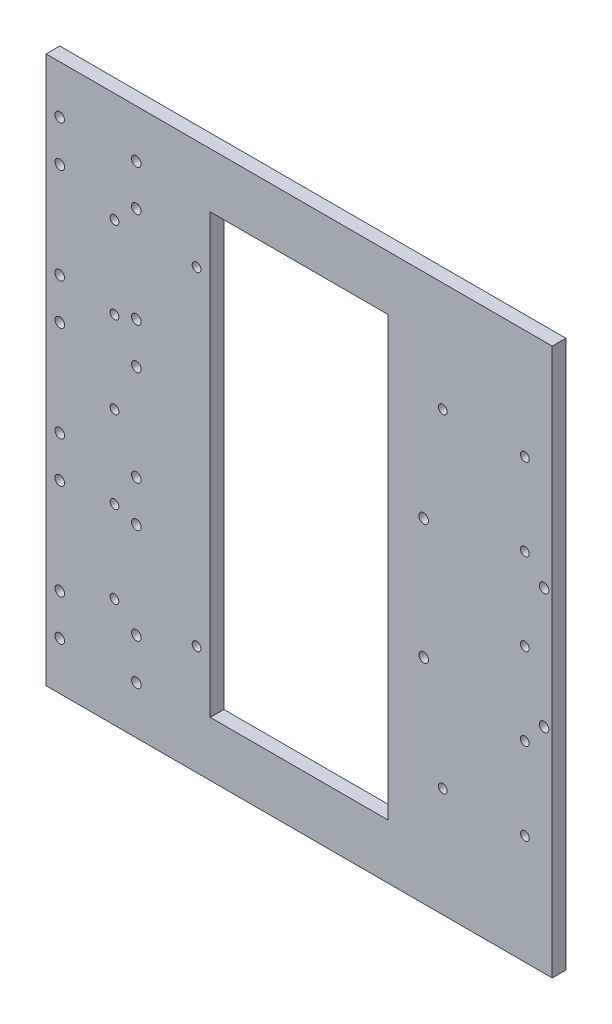
from build123d import *

# Parameters (mm, degrees)
SKETCH_1_W          = 170
SKETCH_1_H          = 140
EXTRUDE_1_DEPTH     = 5
CUT_EXTRUDE_1_DEPTH = 5
SKETCH_4_R          = 1.6
CUT_EXTRUDE_2_DEPTH = 5
SKETCH_9_W          = 170
SKETCH_9_H          = 5
EXTRUDE_2_DEPTH     = 30
SKETCH_10_W         = 170
SKETCH_10_H         = 5
EXTRUDE_3_DEPTH     = 30
SKETCH_8_W          = 65
SKETCH_8_H          = 160
CUT_EXTRUDE_5_DEPTH = 30
SKETCH_6_R          = 1.75
CUT_EXTRUDE_6_DEPTH = 30
SKETCH_13_W         = 5
SKETCH_13_H         = 200
EXTRUDE_4_DEPTH     = 15
SKETCH_14_R         = 1.75
CUT_EXTRUDE_7_DEPTH = 15


with BuildPart() as part:
    # 草图1 → 凸台-拉伸1 (new body)
    with BuildSketch(Plane.XY):
        with Locations((85, 70)):
            Rectangle(SKETCH_1_W, SKETCH_1_H)
    extrude(amount=EXTRUDE_1_DEPTH)

    # 草图3 → 切除-拉伸1 (cut)
    with BuildSketch(Plane.XY.offset(5)):
        with BuildLine():
            ThreePointArc((10, 128.4), (11.13137085, 128.86862915), (11.6, 130))
            Line((11.6, 130), (10, 130))
            Line((10, 130), (10, 128.4))
        make_face()
        with BuildLine():
            Line((10, 130), (11.6, 130))
            ThreePointArc((11.6, 130), (8.86862915, 131.13137085), (10, 128.4))
            Line((10, 128.4), (10, 130))
        make_face()
        with BuildLine():
            ThreePointArc((10, 128.4), (11.13137085, 128.86862915), (11.6, 130))
            Line((11.6, 130), (10, 130))
            Line((10, 130), (10, 128.4))
        make_face()
        with BuildLine():
            Line((10, 130), (11.6, 130))
            ThreePointArc((11.6, 130), (8.86862915, 131.13137085), (10, 128.4))
            Line((10, 128.4), (10, 130))
        make_face()
        with BuildLine():
            ThreePointArc((11.6, 10), (11.13137085, 11.13137085), (10, 11.6))
            Line((10, 11.6), (10, 10))
            Line((10, 10), (11.6, 10))
        make_face()
        with BuildLine():
            Line((10, 10), (10, 11.6))
            ThreePointArc((10, 11.6), (8.86862915, 8.86862915), (11.6, 10))
            Line((11.6, 10), (10, 10))
        make_face()
        with BuildLine():
            ThreePointArc((11.6, 10), (11.13137085, 11.13137085), (10, 11.6))
            Line((10, 11.6), (10, 10))
            Line((10, 10), (11.6, 10))
        make_face()
        with BuildLine():
            Line((10, 10), (10, 11.6))
            ThreePointArc((10, 11.6), (8.86862915, 8.86862915), (11.6, 10))
            Line((11.6, 10), (10, 10))
        make_face()
        with BuildLine():
            ThreePointArc((161.6, 10), (161.13137085, 11.13137085), (160, 11.6))
            Line((160, 11.6), (160, 10))
            Line((160, 10), (158.4, 10))
            ThreePointArc((158.4, 10), (160, 8.4), (161.6, 10))
        make_face()
        with BuildLine():
            Line((160, 10), (160, 11.6))
            ThreePointArc((160, 11.6), (158.86862915, 11.13137085), (158.4, 10))
            Line((158.4, 10), (160, 10))
        make_face()
        with BuildLine():
            ThreePointArc((161.6, 10), (161.13137085, 11.13137085), (160, 11.6))
            Line((160, 11.6), (160, 10))
            Line((160, 10), (158.4, 10))
            ThreePointArc((158.4, 10), (160, 8.4), (161.6, 10))
        make_face()
        with BuildLine():
            Line((160, 10), (160, 11.6))
            ThreePointArc((160, 11.6), (158.86862915, 11.13137085), (158.4, 10))
            Line((158.4, 10), (160, 10))
        make_face()
        with BuildLine():
            ThreePointArc((161.6, 130), (160, 131.6), (158.4, 130))
            Line((158.4, 130), (160, 130))
            Line((160, 130), (160, 128.4))
            ThreePointArc((160, 128.4), (161.13137085, 128.86862915), (161.6, 130))
        make_face()
        with BuildLine():
            Line((160, 130), (158.4, 130))
            ThreePointArc((158.4, 130), (158.86862915, 128.86862915), (160, 128.4))
            Line((160, 128.4), (160, 130))
        make_face()
        with BuildLine():
            ThreePointArc((161.6, 130), (160, 131.6), (158.4, 130))
            Line((158.4, 130), (160, 130))
            Line((160, 130), (160, 128.4))
            ThreePointArc((160, 128.4), (161.13137085, 128.86862915), (161.6, 130))
        make_face()
        with BuildLine():
            Line((160, 130), (158.4, 130))
            ThreePointArc((158.4, 130), (158.86862915, 128.86862915), (160, 128.4))
            Line((160, 128.4), (160, 130))
        make_face()
    extrude(amount=-CUT_EXTRUDE_1_DEPTH, mode=Mode.SUBTRACT)

    # 草图4 → 切除-拉伸2 (cut)
    with BuildSketch(Plane.XY.offset(5)):
        with Locations((10, 130)):
            Circle(SKETCH_4_R)
        with Locations((40, 130)):
            Circle(SKETCH_4_R)
        with Locations((70, 130)):
            Circle(SKETCH_4_R)
        with Locations((100, 130)):
            Circle(SKETCH_4_R)
        with Locations((130, 130)):
            Circle(SKETCH_4_R)
        with Locations((10, 10)):
            Circle(SKETCH_4_R)
        with Locations((40, 10)):
            Circle(SKETCH_4_R)
        with Locations((70, 10)):
            Circle(SKETCH_4_R)
        with Locations((100, 10)):
            Circle(SKETCH_4_R)
        with Locations((130, 10)):
            Circle(SKETCH_4_R)
        with Locations((160, 130)):
            Circle(SKETCH_4_R)
        with Locations((10, 100)):
            Circle(SKETCH_4_R)
        with Locations((160, 100)):
            Circle(SKETCH_4_R)
        with Locations((10, 70)):
            Circle(SKETCH_4_R)
        with Locations((160, 70)):
            Circle(SKETCH_4_R)
        with Locations((10, 40)):
            Circle(SKETCH_4_R)
        with Locations((160, 40)):
            Circle(SKETCH_4_R)
    extrude(amount=-CUT_EXTRUDE_2_DEPTH, mode=Mode.SUBTRACT)

    # 草图9 → 凸台-拉伸2 (add)
    with BuildSketch(Plane.XZ):
        with Locations((85, 2.5)):
            Rectangle(SKETCH_9_W, SKETCH_9_H)
    extrude(amount=EXTRUDE_2_DEPTH)

    # 草图10 → 凸台-拉伸3 (add)
    with BuildSketch(Plane(origin=(0, 140, 0), x_dir=(1, 0, 0), z_dir=(0, 1, 0))):
        with Locations((85, -2.5)):
            Rectangle(SKETCH_10_W, SKETCH_10_H)
    extrude(amount=EXTRUDE_3_DEPTH)

    # 草图8 → 切除-拉伸5 (cut)
    with BuildSketch(Plane.XY.offset(5)):
        with Locations((77.5, 70)):
            Rectangle(SKETCH_8_W, SKETCH_8_H)
    extrude(amount=-CUT_EXTRUDE_5_DEPTH, mode=Mode.SUBTRACT)

    # 草图6 → 切除-拉伸6 (cut)
    with BuildSketch(Plane.XY.offset(5)):
        with Locations((123, 92)):
            Circle(SKETCH_6_R)
        with Locations((167, 92)):
            Circle(SKETCH_6_R)
        with Locations((123, 48)):
            Circle(SKETCH_6_R)
        with Locations((167, 48)):
            Circle(SKETCH_6_R)
    extrude(amount=-CUT_EXTRUDE_6_DEPTH, mode=Mode.SUBTRACT)

    # 草图13 → 凸台-拉伸4 (add)
    with BuildSketch(Plane.ZY):
        with Locations((2.5, 70)):
            Rectangle(SKETCH_13_W, SKETCH_13_H)
    extrude(amount=EXTRUDE_4_DEPTH)

    # 草图14 → 切除-拉伸7 (cut)
    with BuildSketch(Plane.XY.offset(5)):
        with BuildLine():
            ThreePointArc((-8.25, 152.5), (-11.237436867, 153.737436867), (-10, 150.75))
            Line((-10, 150.75), (-10, 152.5))
            Line((-10, 152.5), (-8.25, 152.5))
        make_face()
        with BuildLine():
            Line((-10, 152.5), (-10, 150.75))
            ThreePointArc((-10, 150.75), (-8.762563133, 151.262563133), (-8.25, 152.5))
            Line((-8.25, 152.5), (-10, 152.5))
        make_face()
        with BuildLine():
            ThreePointArc((-8.25, 152.5), (-11.237436867, 153.737436867), (-10, 150.75))
            Line((-10, 150.75), (-10, 152.5))
            Line((-10, 152.5), (-8.25, 152.5))
        make_face()
        with BuildLine():
            Line((-10, 152.5), (-10, 150.75))
            ThreePointArc((-10, 150.75), (-8.762563133, 151.262563133), (-8.25, 152.5))
            Line((-8.25, 152.5), (-10, 152.5))
        make_face()
        with BuildLine():
            Line((-10, 139.25), (-10, 137.5))
            Line((-10, 137.5), (-8.25, 137.5))
            ThreePointArc((-8.25, 137.5), (-8.762563133, 138.737436867), (-10, 139.25))
        make_face()
        with BuildLine():
            Line((-8.25, 137.5), (-10, 137.5))
            Line((-10, 137.5), (-10, 139.25))
            ThreePointArc((-10, 139.25), (-11.237436867, 136.262563133), (-8.25, 137.5))
        make_face()
        with BuildLine():
            Line((-10, 139.25), (-10, 137.5))
            Line((-10, 137.5), (-8.25, 137.5))
            ThreePointArc((-8.25, 137.5), (-8.762563133, 138.737436867), (-10, 139.25))
        make_face()
        with BuildLine():
            Line((-8.25, 137.5), (-10, 137.5))
            Line((-10, 137.5), (-10, 139.25))
            ThreePointArc((-10, 139.25), (-11.237436867, 136.262563133), (-8.25, 137.5))
        make_face()
        with BuildLine():
            ThreePointArc((18, 139.25), (16.762563133, 138.737436867), (16.25, 137.5))
            Line((16.25, 137.5), (18, 137.5))
            Line((18, 137.5), (18, 139.25))
        make_face()
        with BuildLine():
            Line((18, 137.5), (16.25, 137.5))
            ThreePointArc((16.25, 137.5), (18, 135.75), (19.75, 137.5))
            ThreePointArc((19.75, 137.5), (19.237436867, 138.737436867), (18, 139.25))
            Line((18, 139.25), (18, 137.5))
        make_face()
        with BuildLine():
            ThreePointArc((18, 139.25), (16.762563133, 138.737436867), (16.25, 137.5))
            Line((16.25, 137.5), (18, 137.5))
            Line((18, 137.5), (18, 139.25))
        make_face()
        with BuildLine():
            Line((18, 137.5), (16.25, 137.5))
            ThreePointArc((16.25, 137.5), (18, 135.75), (19.75, 137.5))
            ThreePointArc((19.75, 137.5), (19.237436867, 138.737436867), (18, 139.25))
            Line((18, 139.25), (18, 137.5))
        make_face()
        with BuildLine():
            ThreePointArc((16.25, 152.5), (16.762563133, 151.262563133), (18, 150.75))
            Line((18, 150.75), (18, 152.5))
            Line((18, 152.5), (16.25, 152.5))
        make_face()
        with BuildLine():
            Line((18, 152.5), (18, 150.75))
            ThreePointArc((18, 150.75), (19.237436867, 151.262563133), (19.75, 152.5))
            ThreePointArc((19.75, 152.5), (18, 154.25), (16.25, 152.5))
            Line((16.25, 152.5), (18, 152.5))
        make_face()
        with BuildLine():
            ThreePointArc((16.25, 152.5), (16.762563133, 151.262563133), (18, 150.75))
            Line((18, 150.75), (18, 152.5))
            Line((18, 152.5), (16.25, 152.5))
        make_face()
        with BuildLine():
            Line((18, 152.5), (18, 150.75))
            ThreePointArc((18, 150.75), (19.237436867, 151.262563133), (19.75, 152.5))
            ThreePointArc((19.75, 152.5), (18, 154.25), (16.25, 152.5))
            Line((16.25, 152.5), (18, 152.5))
        make_face()
        with Locations((-10, 102.5)):
            Circle(SKETCH_14_R)
        with Locations((18, 102.5)):
            Circle(SKETCH_14_R)
        with Locations((-10, 87.5)):
            Circle(SKETCH_14_R)
        with Locations((18, 87.5)):
            Circle(SKETCH_14_R)
        with Locations((-10, 52.5)):
            Circle(SKETCH_14_R)
        with Locations((18, 52.5)):
            Circle(SKETCH_14_R)
        with Locations((-10, 37.5)):
            Circle(SKETCH_14_R)
        with Locations((18, 37.5)):
            Circle(SKETCH_14_R)
        with Locations((-10, 2.5)):
            Circle(SKETCH_14_R)
        with Locations((18, 2.5)):
            Circle(SKETCH_14_R)
        with Locations((-10, -12.5)):
            Circle(SKETCH_14_R)
        with Locations((18, -12.5)):
            Circle(SKETCH_14_R)
    extrude(amount=-CUT_EXTRUDE_7_DEPTH, mode=Mode.SUBTRACT)


solid = part.part
